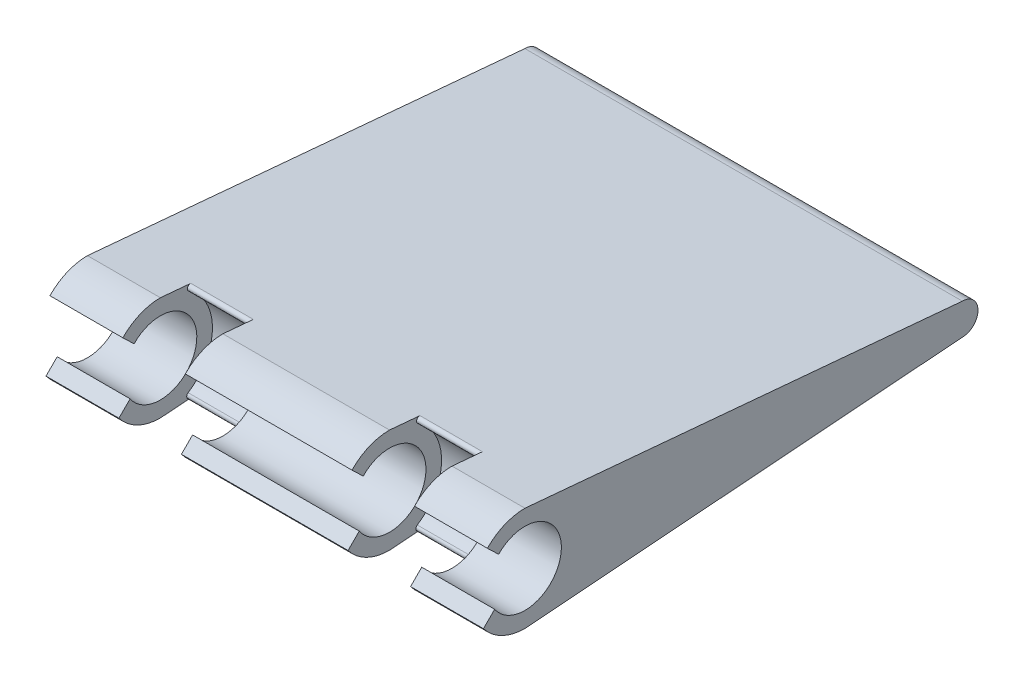
from build123d import *

# Parameters (mm, degrees)
SKETCH1_R           = 3.5
SKETCH1_R_2         = 1.500000000000004
BOSS_EXTRUDE1_DEPTH = 21
CUT_EXTRUDE1_START  = 14
SKETCH1_3_R         = 3.5
CUT_EXTRUDE1_DEPTH  = 6
CUT_EXTRUDE2_START  = -8
SKETCH1_4_R         = 3.5
CUT_EXTRUDE2_DEPTH  = 6
FILLET2_R           = 0.3
CUT_EXTRUDE3_REACH  = 62.673


with BuildPart() as part:
    # Sketch1 → Boss-Extrude1 (new, symmetric)
    # profile 1 of 3: a face of its own
    with BuildSketch(Plane(origin=(0, 0, 0), x_dir=(0, 0, -1), z_dir=(1, 0, 0))):
        with BuildLine():
            ThreePointArc((42, -1.7814888188261242), (40.49999999999999, -0.2814888188261199), (42, 1.2185111811738838))
            Line((42, 1.21851118117388), (0.8931145530180302, 4.919588031043605))
            ThreePointArc((0.8931145530180298, 4.919588031043595), (3.8383311976098513, 3.204249306382842), (5, 0))
            ThreePointArc((5, -1.22e-15), (3.7953387230389426, -3.255058214133985), (0.7618384090395492, -4.9416193943394795))
            Line((0.7618384090395499, -4.9416193943394875), (42, -1.7814888188261202))
        make_face()
    # profile 2 of 3: a face of its own
    with BuildSketch(Plane(origin=(0, 0, 0), x_dir=(0, 0, -1), z_dir=(1, 0, 0))):
        with BuildLine():
            ThreePointArc((5, 0), (3.8383311976098513, 3.204249306382842), (0.8931145530180298, 4.919588031043595))
            Line((0.8931145530180302, 4.919588031043605), (0, 5))
            ThreePointArc((3.1e-16, 5), (-5, 6.1e-16), (-9.2e-16, -5))
            Line((0, -5), (0.7618384090395499, -4.9416193943394875))
            ThreePointArc((0.7618384090395492, -4.9416193943394795), (3.7953387230389426, -3.255058214133985), (5, -1.22e-15))
        make_face()
        with Locations(Location((0, 0, 0), (0, 0, 180))):
            Circle(SKETCH1_R, mode=Mode.SUBTRACT)
    # profile 3 of 3: a face of its own
    with BuildSketch(Plane(origin=(0, 0, 0), x_dir=(0, 0, -1), z_dir=(1, 0, 0))):
        with Locations((42, -0.2814888188261201)):
            Circle(SKETCH1_R_2)
    extrude(amount=BOSS_EXTRUDE1_DEPTH, both=True)

    # Sketch1<3> → Cut-Extrude1 (cut)
    with BuildSketch(Plane(origin=(0, 0, 0), x_dir=(0, 0, -1), z_dir=(1, 0, 0)).offset(CUT_EXTRUDE1_START)):
        with BuildLine():
            ThreePointArc((5, 0), (3.8383311976098513, 3.204249306382842), (0.8931145530180298, 4.919588031043595))
            Line((0.8931145530180302, 4.919588031043605), (0, 5))
            ThreePointArc((3.1e-16, 5), (-5, 6.1e-16), (-9.2e-16, -5))
            Line((0, -5), (0.7618384090395499, -4.9416193943394875))
            ThreePointArc((0.7618384090395492, -4.9416193943394795), (3.7953387230389426, -3.255058214133985), (5, -1.22e-15))
        make_face()
        with Locations(Location((0, 0, 0), (0, 0, 180))):
            Circle(SKETCH1_3_R, mode=Mode.SUBTRACT)
    extrude(amount=-CUT_EXTRUDE1_DEPTH, mode=Mode.SUBTRACT)

    # Sketch1<4> → Cut-Extrude2 (cut)
    with BuildSketch(Plane(origin=(0, 0, 0), x_dir=(0, 0, -1), z_dir=(1, 0, 0)).offset(CUT_EXTRUDE2_START)):
        with BuildLine():
            ThreePointArc((5, 0), (3.8383311976098513, 3.204249306382842), (0.8931145530180298, 4.919588031043595))
            Line((0.8931145530180302, 4.919588031043605), (0, 5))
            ThreePointArc((3.1e-16, 5), (-5, 6.1e-16), (-9.2e-16, -5))
            Line((0, -5), (0.7618384090395499, -4.9416193943394875))
            ThreePointArc((0.7618384090395492, -4.9416193943394795), (3.7953387230389426, -3.255058214133985), (5, -1.22e-15))
        make_face()
        with Locations(Location((0, 0, 0), (0, 0, 180))):
            Circle(SKETCH1_4_R, mode=Mode.SUBTRACT)
    extrude(amount=-CUT_EXTRUDE2_DEPTH, mode=Mode.SUBTRACT)

    # Fillet2
    fillet2_edges = [part.edges().sort_by_distance(p)[0] for p in [
        (11, 4.919588031043601, -0.8931145530180298),
        (11, -4.941619394339483, -0.7618384090395496),
        (-11, 4.919588031043601, -0.8931145530180298),
        (-11, -4.941619394339483, -0.7618384090395496),
    ]]
    fillet(fillet2_edges, radius=FILLET2_R)

    # Cut-Extrude3: up to this face of the body (flat: up to its plane)
    cut_extrude3_end = Plane(part.part.faces().sort_by_distance((-21, -0.117271195, -17.205258384))[0])
    # Sketch2 → Cut-Extrude3 (cut, up to the picked face)
    with BuildSketch(Plane(origin=(21, 0, 0), x_dir=(0, 0, -1), z_dir=(1, 0, 0)), mode=Mode.PRIVATE) as cut_extrude3_sk1:
        with BuildLine():
            Line((-3.6020994823407393, 3.467690776196831), (-2.5214696376385177, 2.4273835433377813))
            ThreePointArc((-2.5214696376385177, 2.4273835433377813), (-3.486645137099691, 0.30545979758239905), (-2.905137986458371, -1.9519665160131723))
            Line((-2.905137986458371, -1.9519665160131723), (-3.979850788994912, -3.026679318549717))
            ThreePointArc((-3.979850788994912, -3.026679318549717), (-4.991563203159533, 0.2903390928961196), (-3.6020994823407393, 3.467690776196831))
        make_face()
    cut_extrude3_tool1 = split(extrude(cut_extrude3_sk1.sketch, amount=-CUT_EXTRUDE3_REACH, mode=Mode.PRIVATE), bisect_by=cut_extrude3_end, keep=Keep.BOTH, mode=Mode.PRIVATE)
    add(cut_extrude3_tool1.solids().sort_by(Axis((21, 0.27388, 3.94965), (-1, 0, 0)))[0], mode=Mode.SUBTRACT)


solid = part.part
